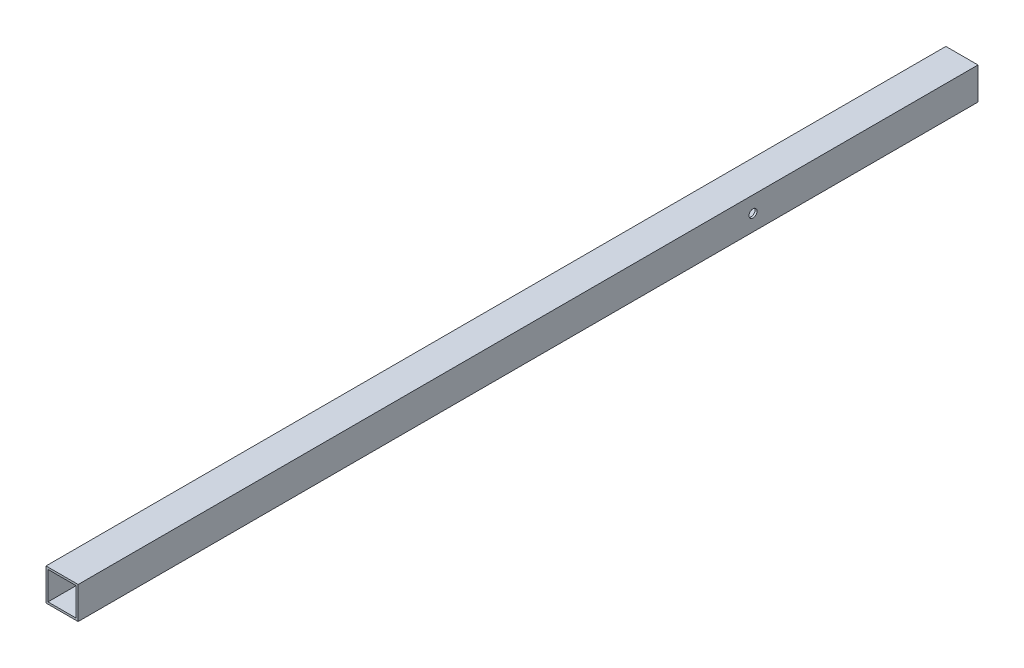
from build123d import *

# Parameters (mm, degrees)
BOSS_EXTRUDE1_DEPTH                = 914.4
BOSS_EXTRUDE1_DEPTH_BACK           = 914.4
SKETCH3_W                          = 25.4
SKETCH3_H                          = 25.4
SKETCH3_W_2                        = 22.225
SKETCH3_H_2                        = 22.225
SKETCH5_W                          = 30.406422512
SKETCH5_H                          = 27.345599006
CUT_EXTRUDE1_DEPTH                 = 1117.6
F_1_4_0_25_DIAMETER_HOLE1_D        = 6.35
F_3_16_0_1875_DIAMETER_HOLE1_D     = 4.7625
F_3_16_0_1875_DIAMETER_HOLE1_DEPTH = 1.5875
F_10_CLEARANCE_HOLE1_D             = 5.1054
F_10_CLEARANCE_HOLE1_DEPTH         = 1.5875


with BuildPart() as part:
    # Sketch3 → Boss-Extrude1 (new, two sides: drawn at the far end of the back side and taken through both)
    with BuildSketch(Plane.XY.offset(-BOSS_EXTRUDE1_DEPTH_BACK)):
        Rectangle(SKETCH3_W, SKETCH3_H)
        Rectangle(SKETCH3_W_2, SKETCH3_H_2, mode=Mode.SUBTRACT)
    extrude(amount=BOSS_EXTRUDE1_DEPTH + BOSS_EXTRUDE1_DEPTH_BACK)

    # Sketch5 → Cut-Extrude1 (cut)
    with BuildSketch(Plane.XY.offset(914.4)):
        Rectangle(SKETCH5_W, SKETCH5_H)
    extrude(amount=-CUT_EXTRUDE1_DEPTH, mode=Mode.SUBTRACT)

    # 1/4 (0.25) Diameter Hole1 (through all)
    with Locations(Plane.ZY.offset(12.7)):
        with Locations((-736.6, 0)):
            Hole(F_1_4_0_25_DIAMETER_HOLE1_D / 2)

    # 3/16 (0.1875) Diameter Hole1
    with Locations(Plane(origin=(0, -12.7, 0), x_dir=(-1, 0, 0), z_dir=(0, -1, 0))):
        with Locations((0, 889), (0, 863.6), (0, 838.2), (0, 279.4), (0, 254), (0, 228.6)):
            Hole(F_3_16_0_1875_DIAMETER_HOLE1_D / 2, depth=F_3_16_0_1875_DIAMETER_HOLE1_DEPTH)

    # #10 Clearance Hole1
    with Locations(Plane(origin=(0, -12.7, 0), x_dir=(-1, 0, 0), z_dir=(0, -1, 0))):
        with Locations((0, 635), (0, 584.2), (0, 533.4), (0, 482.6)):
            Hole(F_10_CLEARANCE_HOLE1_D / 2, depth=F_10_CLEARANCE_HOLE1_DEPTH)


solid = part.part
